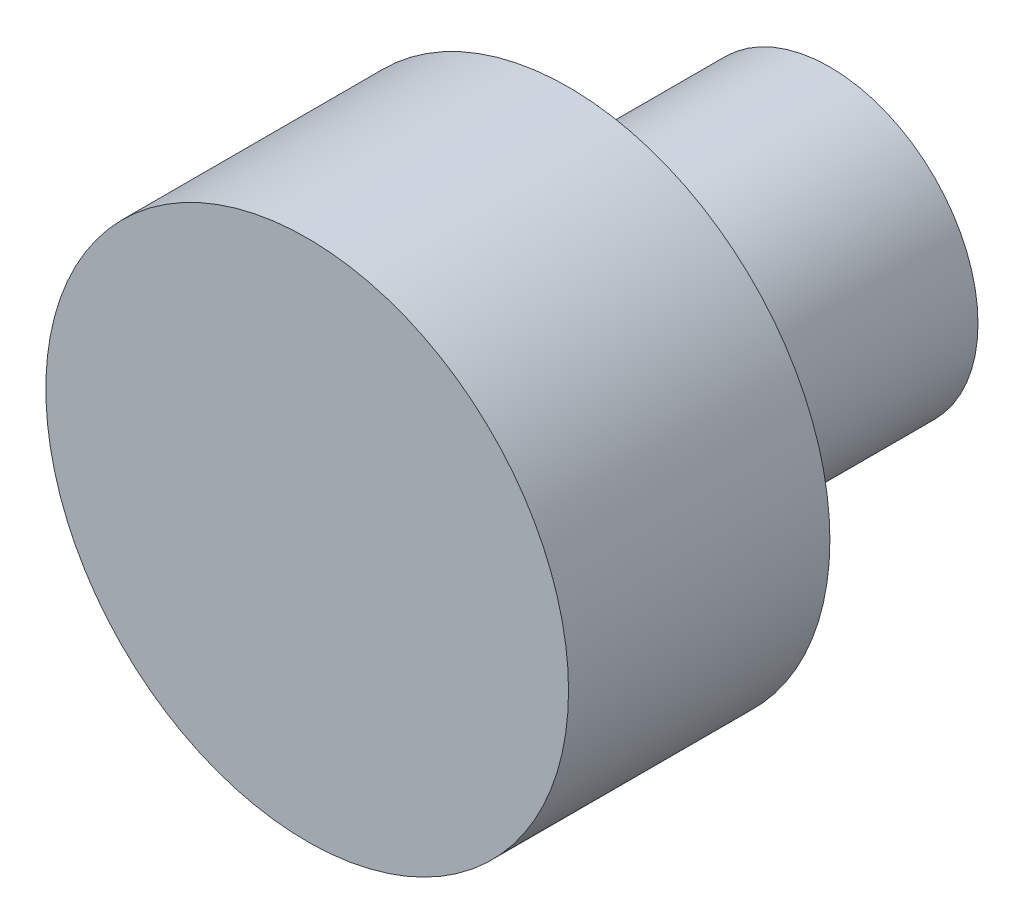
from build123d import *

# Parameters (mm, degrees)
SKETCH1_R           = 6
BOSS_EXTRUDE1_DEPTH = 6
SKETCH1_3_R         = 3.4
BOSS_EXTRUDE2_DEPTH = 6


with BuildPart() as part:
    # Sketch1 → Boss-Extrude1 (new body)
    with BuildSketch(Plane.XY):
        Circle(SKETCH1_R)
    extrude(amount=BOSS_EXTRUDE1_DEPTH)

    # Sketch1<3> → Boss-Extrude2 (add)
    with BuildSketch(Plane.XY):
        Circle(SKETCH1_3_R)
    extrude(amount=-BOSS_EXTRUDE2_DEPTH)


solid = part.part
